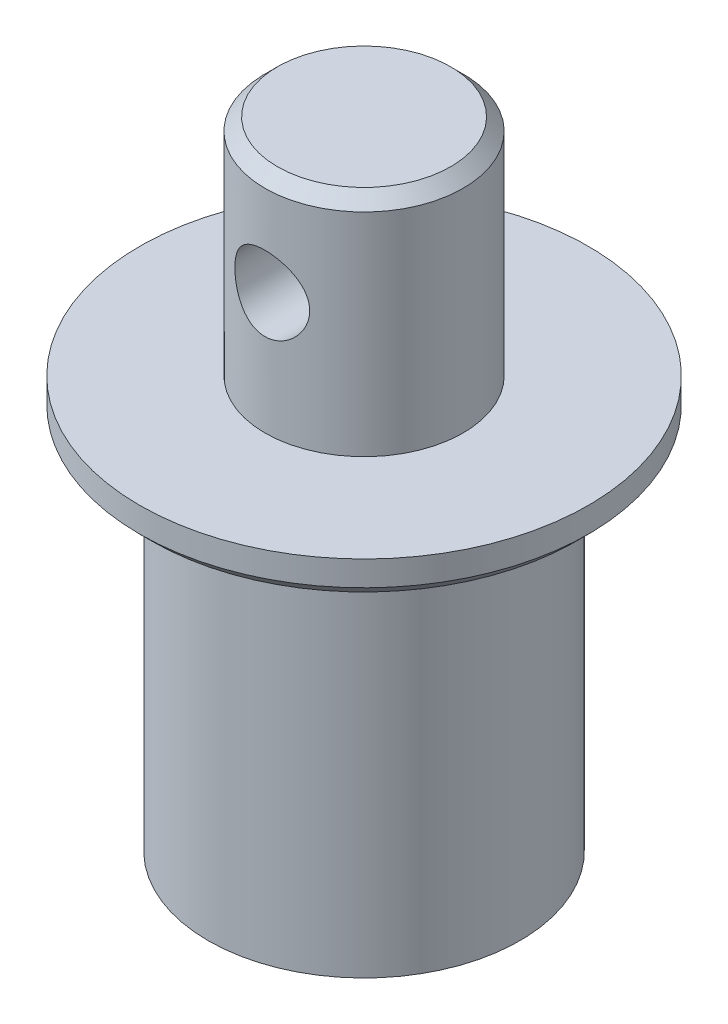
from build123d import *

# Parameters (mm, degrees)
SKETCH_1_R               = 7.95
EXTRUDE_1_DEPTH          = 18
CHAMFER_2_SIZE           = 1
SKETCH_4_R               = 18
EXTRUDE_2_DEPTH          = 3
CHAMFER_1_SIZE           = 1
SKETCH_5_R               = 12.5
EXTRUDE_3_DEPTH          = 30
CUT_EXTRUDE_2_DEPTH      = 42.677331968
CUT_EXTRUDE_2_DEPTH_BACK = 42.677331968
SKETCH_9_R               = 3
CUT_EXTRUDE_START        = 30
SKETCH_10_R              = 7.95
CUT_EXTRUDE_3_DEPTH      = 20


with BuildPart() as part:
    # 草图1 → 凸台-拉伸1 (new body)
    with BuildSketch(Plane(origin=(0, 0, 0), x_dir=(1, 0, 0), z_dir=(0, 1, 0))):
        with Locations(Location((0, 0, 0), (0, 0, 270))):
            Circle(SKETCH_1_R)
    extrude(amount=EXTRUDE_1_DEPTH)

    # 倒角2
    chamfer_2_edges = [part.edges().sort_by_distance(p)[0] for p in [
        (0, 18, -7.95),
    ]]
    chamfer(chamfer_2_edges, length=CHAMFER_2_SIZE)

    # 草图4 → 凸台-拉伸2 (add)
    with BuildSketch(Plane(origin=(0, 0, 0), x_dir=(1, 0, 0), z_dir=(0, 1, 0))):
        with Locations(Location((0, 0, 0), (0, 0, 270))):
            Circle(SKETCH_4_R)
    extrude(amount=-EXTRUDE_2_DEPTH)

    # 倒角1
    chamfer_1_edges = [part.edges().sort_by_distance(p)[0] for p in [
        (0, -3, -18),
    ]]
    chamfer(chamfer_1_edges, length=CHAMFER_1_SIZE)

    # 草图5 → 凸台-拉伸3 (add)
    with BuildSketch(Plane(origin=(0, -3, 0), x_dir=(-1, 0, 0), z_dir=(0, -1, 0))):
        with Locations(Location((0, 0, 0), (0, 0, 90))):
            Circle(SKETCH_5_R)
    extrude(amount=EXTRUDE_3_DEPTH)

    # 草图9 → 切除-拉伸2 (cut, two sides: drawn at the far end of the back side and taken through both)
    with BuildSketch(Plane.XY.offset(-CUT_EXTRUDE_2_DEPTH_BACK)):
        with Locations(Location((0, 9.7, 0), (0, 0, 89.999999999))):
            Circle(SKETCH_9_R)
    extrude(amount=CUT_EXTRUDE_2_DEPTH + CUT_EXTRUDE_2_DEPTH_BACK, mode=Mode.SUBTRACT)

    # 草图10 → 切除-拉伸3 (cut)
    with BuildSketch(Plane(origin=(0, -3, 0), x_dir=(-1, 0, 0), z_dir=(0, -1, 0)).offset(CUT_EXTRUDE_START)):
        with Locations(Location((0, 0, 0), (0, 0, 270))):
            Circle(SKETCH_10_R)
    extrude(amount=-CUT_EXTRUDE_3_DEPTH, mode=Mode.SUBTRACT)


solid = part.part
